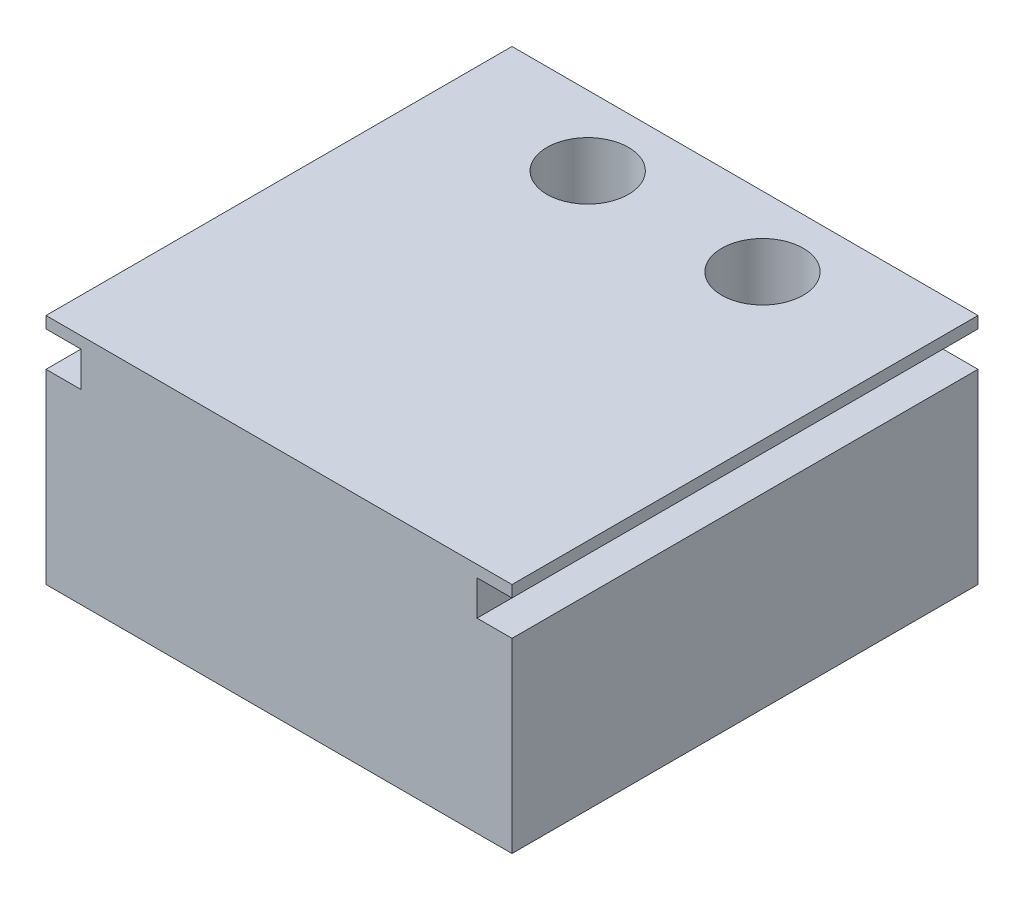
from build123d import *

# Parameters (mm, degrees)
SKETCH1_W           = 40
SKETCH1_H           = 40
BOSS_EXTRUDE1_DEPTH = 20
SKETCH2_R           = 3.5
CUT_EXTRUDE1_DEPTH  = 15
SKETCH3_W           = 40
SKETCH3_H           = 3
CUT_EXTRUDE2_DEPTH  = 3


with BuildPart() as part:
    # Sketch1 → Boss-Extrude1 (new body)
    with BuildSketch(Plane(origin=(0, 0, 0), x_dir=(1, 0, 0), z_dir=(0, 1, 0))):
        with Locations((-5.853997969, 11.508758813)):
            Rectangle(SKETCH1_W, SKETCH1_H)
    extrude(amount=BOSS_EXTRUDE1_DEPTH)

    # Sketch2 → Cut-Extrude1 (cut)
    with BuildSketch(Plane(origin=(0, 20, 0), x_dir=(1, 0, 0), z_dir=(0, 1, 0))):
        with Locations(Location((-13.353997969, 25.508758813, 0), (0, 0, 270))):
            Circle(SKETCH2_R)
        with Locations(Location((1.646002031, 25.508758813, 0), (0, 0, 270))):
            Circle(SKETCH2_R)
    extrude(amount=-CUT_EXTRUDE1_DEPTH, mode=Mode.SUBTRACT)

    # Sketch3 → Cut-Extrude2 (cut)
    with BuildSketch(Plane(origin=(14.146002031, 0, 0), x_dir=(0, 0, -1), z_dir=(1, 0, 0))):
        with Locations((11.508758813, 17.5)):
            Rectangle(SKETCH3_W, SKETCH3_H)
    cut_extrude2 = extrude(amount=-CUT_EXTRUDE2_DEPTH, mode=Mode.SUBTRACT)

    # Mirror1: Cut-Extrude2 across plane
    add(cut_extrude2.mirror(Plane(origin=(-5.853997969, 0, 0), x_dir=(0, 0, 1), z_dir=(1, 0, 0))), mode=Mode.SUBTRACT)


solid = part.part
